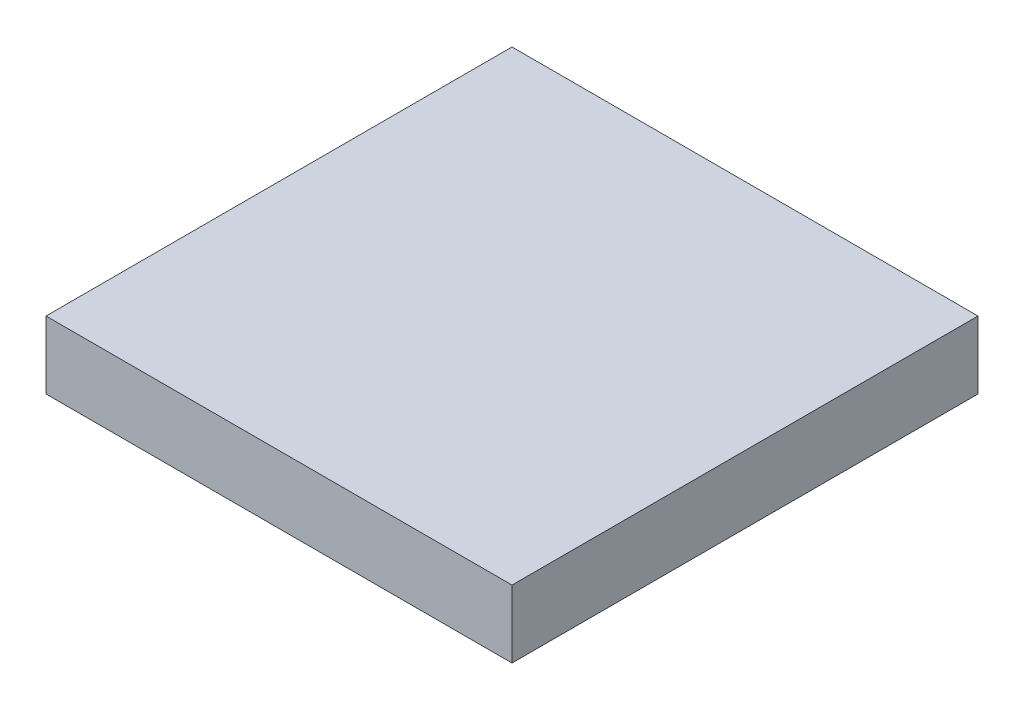
from build123d import *

# Parameters (mm, degrees)
SKETCH1_W           = 35.052
SKETCH1_H           = 35.052
BOSS_EXTRUDE1_DEPTH = 5.08


with BuildPart() as part:
    # Sketch1 → Boss-Extrude1 (new body)
    with BuildSketch(Plane(origin=(0, 0, 0), x_dir=(1, 0, 0), z_dir=(0, 1, 0))):
        with Locations((17.526, 17.526)):
            Rectangle(SKETCH1_W, SKETCH1_H)
    extrude(amount=BOSS_EXTRUDE1_DEPTH)


solid = part.part
